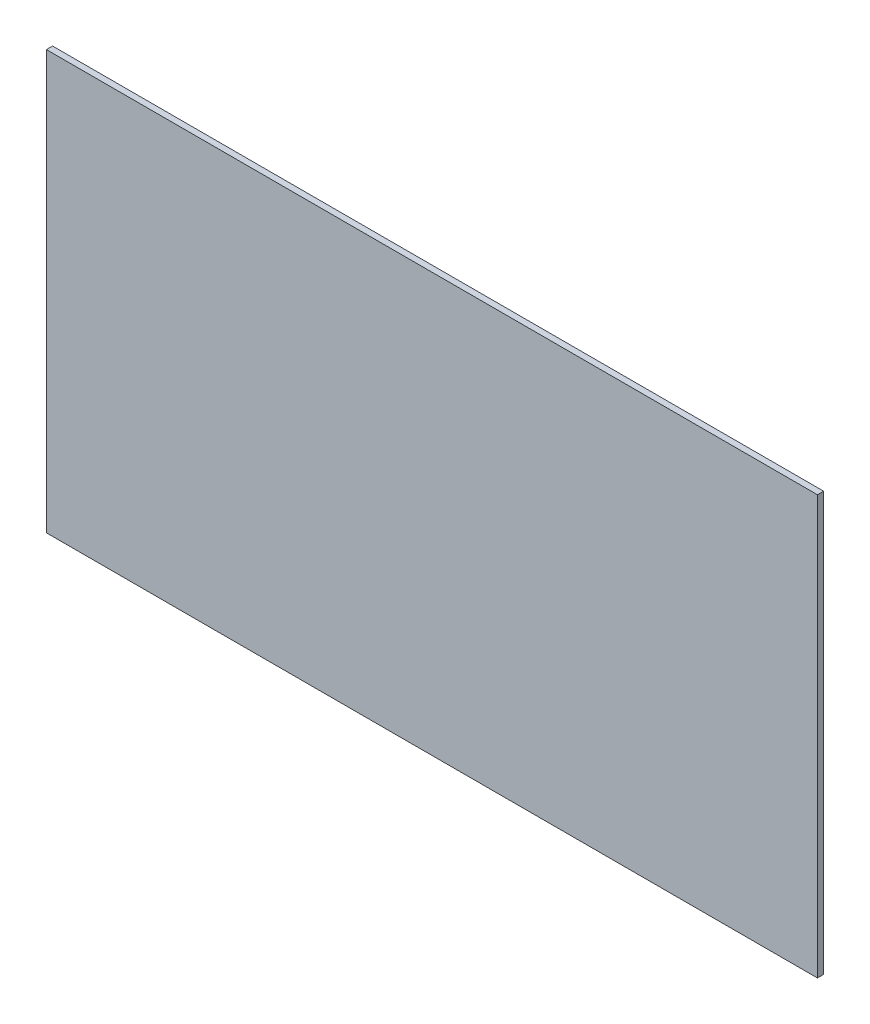
from build123d import *

# Parameters (mm, degrees)
ESQUISSE1_W        = 374
ESQUISSE1_H        = 203
BOSS_EXTRU_1_DEPTH = 3


with BuildPart() as part:
    # Esquisse1 → Boss.-Extru.1 (new body)
    with BuildSketch(Plane.XY):
        with Locations((187, 101.5)):
            Rectangle(ESQUISSE1_W, ESQUISSE1_H)
    extrude(amount=BOSS_EXTRU_1_DEPTH)


solid = part.part
